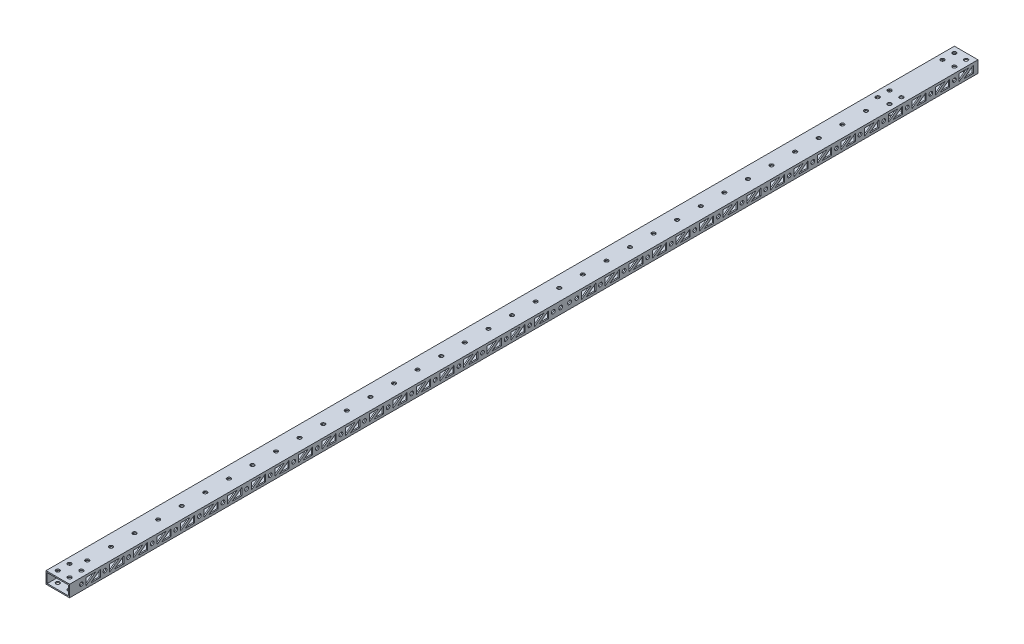
from build123d import *

# Parameters (mm, degrees)
SKETCH_1_W          = 20
SKETCH_1_H          = 10
SKETCH_1_W_2        = 18
SKETCH_1_H_2        = 8
EXTRUDE_1_DEPTH     = 770
SKETCH_2_R          = 1.575
SKETCH_2_R_2        = 1.6
CUT_EXTRUDE_1_DEPTH = 771.324606903
SKETCH_4_R          = 1.575
SKETCH_4_R_2        = 1.6
CUT_EXTRUDE_2_DEPTH = 771.324606903


with BuildPart() as part:
    # 草图1 → 拉伸-薄壁1 (new body)
    with BuildSketch(Plane.XY):
        with Locations((10, -5)):
            Rectangle(SKETCH_1_W, SKETCH_1_H)
        with Locations((10, -5)):
            Rectangle(SKETCH_1_W_2, SKETCH_1_H_2, mode=Mode.SUBTRACT)
    extrude(amount=EXTRUDE_1_DEPTH)

    # 草图2 → 切除-拉伸1 (cut, through all)
    with BuildSketch(Plane.XZ.offset(10)):
        with Locations(Location((5, 5, 0), (0, 0, 270))):
            Circle(SKETCH_2_R)
        with Locations(Location((15, 5, 0), (0, 0, 270))):
            Circle(SKETCH_2_R)
        with Locations(Location((15, 15, 0), (0, 0, 270))):
            Circle(SKETCH_2_R)
        with Locations(Location((5, 15, 0), (0, 0, 270))):
            Circle(SKETCH_2_R)
        with Locations(Location((10, 85, 0), (0, 0, 270))):
            Circle(SKETCH_2_R)
        with Locations(Location((10, 105, 0), (0, 0, 270))):
            Circle(SKETCH_2_R)
        with Locations(Location((10, 125, 0), (0, 0, 270))):
            Circle(SKETCH_2_R)
        with Locations(Location((10, 145, 0), (0, 0, 270))):
            Circle(SKETCH_2_R)
        with Locations(Location((10, 165, 0), (0, 0, 270))):
            Circle(SKETCH_2_R)
        with Locations(Location((10, 185, 0), (0, 0, 270))):
            Circle(SKETCH_2_R)
        with Locations(Location((10, 205, 0), (0, 0, 270))):
            Circle(SKETCH_2_R)
        with Locations(Location((10, 225, 0), (0, 0, 270))):
            Circle(SKETCH_2_R)
        with Locations(Location((10, 245, 0), (0, 0, 270))):
            Circle(SKETCH_2_R)
        with Locations(Location((10, 265, 0), (0, 0, 270))):
            Circle(SKETCH_2_R)
        with Locations(Location((10, 285, 0), (0, 0, 270))):
            Circle(SKETCH_2_R)
        with Locations(Location((10, 305, 0), (0, 0, 270))):
            Circle(SKETCH_2_R)
        with Locations(Location((10, 325, 0), (0, 0, 270))):
            Circle(SKETCH_2_R)
        with Locations(Location((10, 345, 0), (0, 0, 270))):
            Circle(SKETCH_2_R)
        with Locations(Location((10, 365, 0), (0, 0, 270))):
            Circle(SKETCH_2_R)
        with Locations(Location((10, 385, 0), (0, 0, 270))):
            Circle(SKETCH_2_R)
        with Locations(Location((10, 405, 0), (0, 0, 270))):
            Circle(SKETCH_2_R)
        with Locations(Location((10, 425, 0), (0, 0, 270))):
            Circle(SKETCH_2_R)
        with Locations(Location((10, 445, 0), (0, 0, 270))):
            Circle(SKETCH_2_R)
        with Locations(Location((10, 465, 0), (0, 0, 270))):
            Circle(SKETCH_2_R)
        with Locations(Location((10, 485, 0), (0, 0, 270))):
            Circle(SKETCH_2_R)
        with Locations(Location((10, 505, 0), (0, 0, 270))):
            Circle(SKETCH_2_R)
        with Locations(Location((10, 525, 0), (0, 0, 270))):
            Circle(SKETCH_2_R)
        with Locations(Location((10, 545, 0), (0, 0, 270))):
            Circle(SKETCH_2_R)
        with Locations(Location((10, 565, 0), (0, 0, 270))):
            Circle(SKETCH_2_R)
        with Locations(Location((10, 585, 0), (0, 0, 270))):
            Circle(SKETCH_2_R)
        with Locations(Location((10, 605, 0), (0, 0, 270))):
            Circle(SKETCH_2_R)
        with Locations(Location((10, 625, 0), (0, 0, 270))):
            Circle(SKETCH_2_R)
        with Locations(Location((10, 645, 0), (0, 0, 270))):
            Circle(SKETCH_2_R)
        with Locations(Location((10, 665, 0), (0, 0, 270))):
            Circle(SKETCH_2_R)
        with Locations(Location((10, 685, 0), (0, 0, 270))):
            Circle(SKETCH_2_R)
        with Locations(Location((10, 705, 0), (0, 0, 270))):
            Circle(SKETCH_2_R)
        with Locations(Location((10, 725, 0), (0, 0, 270))):
            Circle(SKETCH_2_R)
        with Locations(Location((5, 755, 0), (0, 0, 270))):
            Circle(SKETCH_2_R)
        with Locations(Location((15, 755, 0), (0, 0, 270))):
            Circle(SKETCH_2_R)
        with Locations(Location((15, 765, 0), (0, 0, 270))):
            Circle(SKETCH_2_R)
        with Locations(Location((5, 765, 0), (0, 0, 270))):
            Circle(SKETCH_2_R)
        with Locations(Location((10, 745, 0), (0, 0, 270))):
            Circle(SKETCH_2_R)
        with Locations(Location((5, 70, 0), (0, 0, 270))):
            Circle(SKETCH_2_R_2)
        with Locations(Location((15, 70, 0), (0, 0, 270))):
            Circle(SKETCH_2_R_2)
        with Locations(Location((15, 60, 0), (0, 0, 270))):
            Circle(SKETCH_2_R_2)
        with Locations(Location((5, 60, 0), (0, 0, 270))):
            Circle(SKETCH_2_R_2)
    extrude(amount=-CUT_EXTRUDE_1_DEPTH, mode=Mode.SUBTRACT)

    # 草图4 → 切除-拉伸2 (cut, through all)
    with BuildSketch(Plane(origin=(20, 0, 0), x_dir=(0, 0, -1), z_dir=(1, 0, 0))):
        with Locations(Location((-20, -5, 0), (0, 0, 90))):
            Circle(SKETCH_4_R)
        with Locations(Location((-40, -5, 0), (0, 0, 90))):
            Circle(SKETCH_4_R)
        with Locations(Location((-60, -5, 0), (0, 0, 90))):
            Circle(SKETCH_4_R)
        with Locations(Location((-80, -5, 0), (0, 0, 90))):
            Circle(SKETCH_4_R)
        with Locations(Location((-100, -5, 0), (0, 0, 90))):
            Circle(SKETCH_4_R)
        with Locations(Location((-120, -5, 0), (0, 0, 90))):
            Circle(SKETCH_4_R)
        with Locations(Location((-140, -5, 0), (0, 0, 90))):
            Circle(SKETCH_4_R)
        with Locations(Location((-160, -5, 0), (0, 0, 90))):
            Circle(SKETCH_4_R)
        with Locations(Location((-180, -5, 0), (0, 0, 90))):
            Circle(SKETCH_4_R)
        with Locations(Location((-200, -5, 0), (0, 0, 90))):
            Circle(SKETCH_4_R)
        with Locations(Location((-220, -5, 0), (0, 0, 90))):
            Circle(SKETCH_4_R)
        with Locations(Location((-240, -5, 0), (0, 0, 90))):
            Circle(SKETCH_4_R)
        with Locations(Location((-260, -5, 0), (0, 0, 90))):
            Circle(SKETCH_4_R)
        with Locations(Location((-280, -5, 0), (0, 0, 90))):
            Circle(SKETCH_4_R)
        with Locations(Location((-300, -5, 0), (0, 0, 90))):
            Circle(SKETCH_4_R)
        with Locations(Location((-320, -5, 0), (0, 0, 90))):
            Circle(SKETCH_4_R)
        with Locations(Location((-340, -5, 0), (0, 0, 90))):
            Circle(SKETCH_4_R)
        with Locations(Location((-360, -5, 0), (0, 0, 90))):
            Circle(SKETCH_4_R)
        with Locations(Location((-380, -5, 0), (0, 0, 90))):
            Circle(SKETCH_4_R)
        with Locations(Location((-400, -5, 0), (0, 0, 90))):
            Circle(SKETCH_4_R)
        with Locations(Location((-420, -5, 0), (0, 0, 90))):
            Circle(SKETCH_4_R)
        with Locations(Location((-440, -5, 0), (0, 0, 90))):
            Circle(SKETCH_4_R)
        with Locations(Location((-460, -5, 0), (0, 0, 90))):
            Circle(SKETCH_4_R)
        with Locations(Location((-480, -5, 0), (0, 0, 90))):
            Circle(SKETCH_4_R)
        with Locations(Location((-500, -5, 0), (0, 0, 90))):
            Circle(SKETCH_4_R)
        with Locations(Location((-520, -5, 0), (0, 0, 90))):
            Circle(SKETCH_4_R)
        with Locations(Location((-540, -5, 0), (0, 0, 90))):
            Circle(SKETCH_4_R)
        with Locations(Location((-560, -5, 0), (0, 0, 90))):
            Circle(SKETCH_4_R)
        with Locations(Location((-580, -5, 0), (0, 0, 90))):
            Circle(SKETCH_4_R)
        with Locations(Location((-600, -5, 0), (0, 0, 90))):
            Circle(SKETCH_4_R)
        with Locations(Location((-620, -5, 0), (0, 0, 90))):
            Circle(SKETCH_4_R)
        with Locations(Location((-640, -5, 0), (0, 0, 90))):
            Circle(SKETCH_4_R)
        with Locations(Location((-660, -5, 0), (0, 0, 90))):
            Circle(SKETCH_4_R)
        with Locations(Location((-680, -5, 0), (0, 0, 90))):
            Circle(SKETCH_4_R)
        with Locations(Location((-700, -5, 0), (0, 0, 90))):
            Circle(SKETCH_4_R)
        with Locations(Location((-720, -5, 0), (0, 0, 90))):
            Circle(SKETCH_4_R)
        with Locations(Location((-740, -5, 0), (0, 0, 90))):
            Circle(SKETCH_4_R)
        with Locations(Location((-760, -5, 0), (0, 0, 90))):
            Circle(SKETCH_4_R)
        with Locations(Location((-353.75, -5, 0), (0, 0, 90))):
            Circle(SKETCH_4_R_2)
        with Locations(Location((-346.25, -5, 0), (0, 0, 270))):
            Circle(SKETCH_4_R_2)
        Polygon((-4, -2), (-4, -8), (-12, -8), align=None)
        Polygon((-8, -2), (-16, -8), (-16, -2), align=None)
        Polygon((-24, -2), (-24, -8), (-32, -8), align=None)
        Polygon((-36, -2), (-28, -2), (-36, -8), align=None)
        Polygon((-44, -2), (-44, -8), (-52, -8), align=None)
        Polygon((-56, -2), (-48, -2), (-56, -8), align=None)
        Polygon((-64, -2), (-64, -8), (-72, -8), align=None)
        Polygon((-76, -2), (-68, -2), (-76, -8), align=None)
        Polygon((-84, -2), (-84, -8), (-92, -8), align=None)
        Polygon((-96, -2), (-88, -2), (-96, -8), align=None)
        Polygon((-104, -2), (-104, -8), (-112, -8), align=None)
        Polygon((-116, -2), (-108, -2), (-116, -8), align=None)
        Polygon((-124, -2), (-124, -8), (-132, -8), align=None)
        Polygon((-136, -2), (-128, -2), (-136, -8), align=None)
        Polygon((-144, -2), (-144, -8), (-152, -8), align=None)
        Polygon((-156, -2), (-148, -2), (-156, -8), align=None)
        Polygon((-164, -2), (-164, -8), (-172, -8), align=None)
        Polygon((-176, -2), (-168, -2), (-176, -8), align=None)
        Polygon((-184, -2), (-184, -8), (-192, -8), align=None)
        Polygon((-196, -2), (-188, -2), (-196, -8), align=None)
        Polygon((-204, -2), (-204, -8), (-212, -8), align=None)
        Polygon((-216, -2), (-208, -2), (-216, -8), align=None)
        Polygon((-224, -2), (-224, -8), (-232, -8), align=None)
        Polygon((-236, -2), (-228, -2), (-236, -8), align=None)
        Polygon((-244, -2), (-244, -8), (-252, -8), align=None)
        Polygon((-256, -2), (-248, -2), (-256, -8), align=None)
        Polygon((-264, -2), (-264, -8), (-272, -8), align=None)
        Polygon((-276, -2), (-268, -2), (-276, -8), align=None)
        Polygon((-284, -2), (-284, -8), (-292, -8), align=None)
        Polygon((-296, -2), (-288, -2), (-296, -8), align=None)
        Polygon((-304, -2), (-304, -8), (-312, -8), align=None)
        Polygon((-316, -2), (-308, -2), (-316, -8), align=None)
        Polygon((-324, -2), (-324, -8), (-332, -8), align=None)
        Polygon((-336, -2), (-328, -2), (-336, -8), align=None)
        Polygon((-364, -2), (-364, -8), (-372, -8), align=None)
        Polygon((-376, -2), (-368, -2), (-376, -8), align=None)
        Polygon((-384, -2), (-384, -8), (-392, -8), align=None)
        Polygon((-396, -2), (-388, -2), (-396, -8), align=None)
        Polygon((-404, -2), (-404, -8), (-412, -8), align=None)
        Polygon((-416, -2), (-408, -2), (-416, -8), align=None)
        Polygon((-424, -2), (-424, -8), (-432, -8), align=None)
        Polygon((-436, -2), (-428, -2), (-436, -8), align=None)
        Polygon((-444, -2), (-444, -8), (-452, -8), align=None)
        Polygon((-456, -2), (-448, -2), (-456, -8), align=None)
        Polygon((-464, -2), (-464, -8), (-472, -8), align=None)
        Polygon((-476, -2), (-468, -2), (-476, -8), align=None)
        Polygon((-484, -2), (-484, -8), (-492, -8), align=None)
        Polygon((-496, -2), (-488, -2), (-496, -8), align=None)
        Polygon((-504, -2), (-504, -8), (-512, -8), align=None)
        Polygon((-516, -2), (-508, -2), (-516, -8), align=None)
        Polygon((-524, -2), (-524, -8), (-532, -8), align=None)
        Polygon((-536, -2), (-528, -2), (-536, -8), align=None)
        Polygon((-544, -2), (-544, -8), (-552, -8), align=None)
        Polygon((-556, -2), (-548, -2), (-556, -8), align=None)
        Polygon((-564, -2), (-564, -8), (-572, -8), align=None)
        Polygon((-576, -2), (-568, -2), (-576, -8), align=None)
        Polygon((-584, -2), (-584, -8), (-592, -8), align=None)
        Polygon((-596, -2), (-588, -2), (-596, -8), align=None)
        Polygon((-604, -2), (-604, -8), (-612, -8), align=None)
        Polygon((-616, -2), (-608, -2), (-616, -8), align=None)
        Polygon((-624, -2), (-624, -8), (-632, -8), align=None)
        Polygon((-636, -2), (-628, -2), (-636, -8), align=None)
        Polygon((-644, -2), (-644, -8), (-652, -8), align=None)
        Polygon((-656, -2), (-648, -2), (-656, -8), align=None)
        Polygon((-664, -2), (-664, -8), (-672, -8), align=None)
        Polygon((-676, -2), (-668, -2), (-676, -8), align=None)
        Polygon((-684, -2), (-684, -8), (-692, -8), align=None)
        Polygon((-696, -2), (-688, -2), (-696, -8), align=None)
        Polygon((-704, -2), (-704, -8), (-712, -8), align=None)
        Polygon((-716, -2), (-708, -2), (-716, -8), align=None)
        Polygon((-724, -2), (-724, -8), (-732, -8), align=None)
        Polygon((-736, -2), (-728, -2), (-736, -8), align=None)
        Polygon((-744, -2), (-744, -8), (-752, -8), align=None)
        Polygon((-756, -2), (-748, -2), (-756, -8), align=None)
    extrude(amount=-CUT_EXTRUDE_2_DEPTH, mode=Mode.SUBTRACT)


solid = part.part
